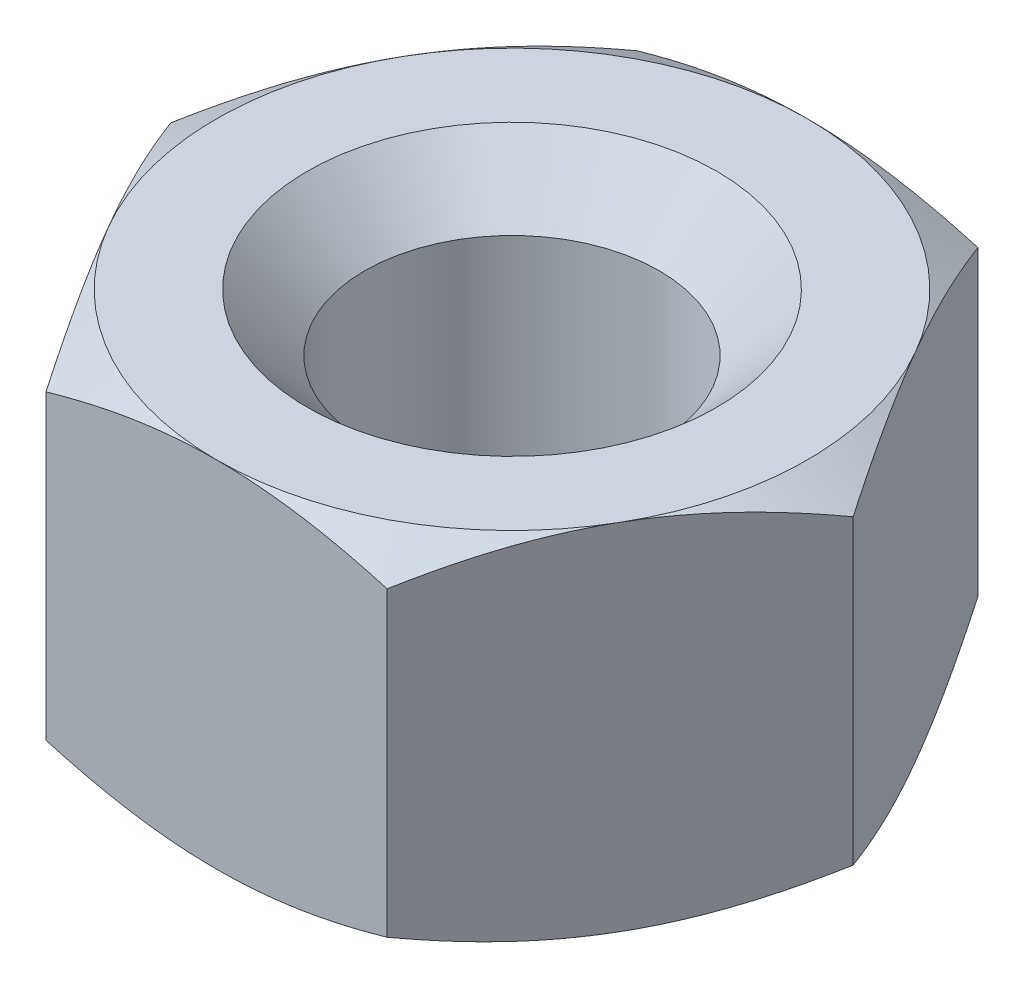
from build123d import *

# Parameters (mm, degrees)
ESQUISSE2_OUTSIDE_W     = 34.974
ESQUISSE2_OUTSIDE_H     = 34.974
ENL_V_MAT_EXTRU_1_DEPTH = 10.8
CHANFREIN_SIZE          = 1.75


with BuildPart() as part:
    # Esquisse1 → Base-Révolution (revolve)
    with BuildSketch(Plane.XY):
        Polygon((4.484455543, 10.8), (9, 10.8), (12.727922061, 8.647683156), (12.727922061, 2.152316844), (9, 0), (4.484455543, 0), align=None)
    revolve(axis=Axis((0, 2.4, 0), (0, -1, 0)))

    # Esquisse2 outside → Enlèv. mat.-Extru.1 (cut)
    with BuildSketch(Plane(origin=(0, 0, 0), x_dir=(1, 0, 0), z_dir=(0, 1, 0))):
        Rectangle(ESQUISSE2_OUTSIDE_W, ESQUISSE2_OUTSIDE_H)
        Polygon((-5.196152423, -9), (5.196152423, -9), (10.392304845, 0), (5.196152423, 9), (-5.196152423, 9), (-10.392304845, 0), align=None, mode=Mode.SUBTRACT)
    extrude(amount=ENL_V_MAT_EXTRU_1_DEPTH, mode=Mode.SUBTRACT)

    # Chanfrein
    chanfrein_edges = [part.edges().sort_by_distance(p)[0] for p in [
        (-4.484455543, 10.8, 0),
        (-4.484455543, 0, 0),
    ]]
    chamfer(chanfrein_edges, length=CHANFREIN_SIZE)


solid = part.part
